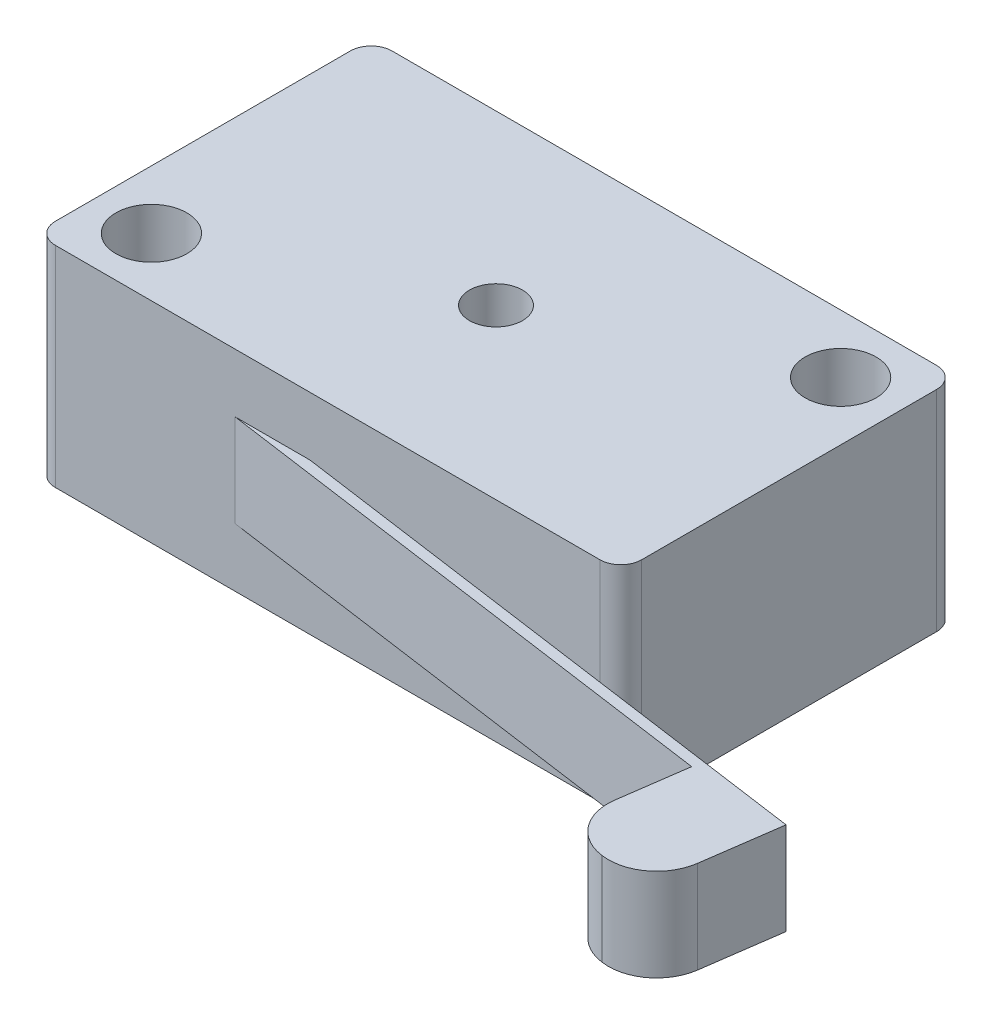
from build123d import *

# Parameters (mm, degrees)
SKETCH1_W               = 28.09
SKETCH1_H               = 16.13
BOSS_EXTRUDE1_DEPTH     = 10.05
BOSS_EXTRUDE2_DEPTH     = 2.215
FILLET1_R               = 1
CUT_EXTRUDE1_DEPTH      = 29.919874566
CUT_EXTRUDE1_DEPTH_BACK = 29.919874566
SKETCH4_R               = 1.7
SKETCH4_R_2             = 1.27
SKETCH6_W               = 4.65
SKETCH6_H               = 4.43
BOSS_EXTRUDE3_DEPTH     = 5.56
FILLET2_R               = 2.3


with BuildPart() as part:
    # Sketch1 → Boss-Extrude1 (new body)
    with BuildSketch(Plane(origin=(0, 0, 0), x_dir=(1, 0, 0), z_dir=(0, 1, 0))):
        Rectangle(SKETCH1_W, SKETCH1_H)
    extrude(amount=BOSS_EXTRUDE1_DEPTH)

    # Sketch3 → Boss-Extrude2 (add, symmetric)
    with BuildSketch(Plane(origin=(0, 5.025, 0), x_dir=(1, 0, 0), z_dir=(0, 1, 0))):
        Polygon((25.656861405, -12.042567225), (25.622068129, -12.290134243), (-4.441324134, -8.065), (-4.371737583, -7.569865966), (25.69165468, -11.795000208), align=None)
    extrude(amount=BOSS_EXTRUDE2_DEPTH, both=True)

    # Fillet1
    fillet1_edges = [part.edges().sort_by_distance(p)[0] for p in [
        (14.045, 5.025, 8.065),
        (-14.045, 5.025, 8.065),
        (-14.045, 5.025, -8.065),
        (14.045, 5.025, -8.065),
    ]]
    fillet(fillet1_edges, radius=FILLET1_R)

    # Sketch4 → Cut-Extrude1 (cut, two sides: drawn at the far end of the back side and taken through both)
    with BuildSketch(Plane(origin=(0, 5.025, 0), x_dir=(1, 0, 0), z_dir=(0, 1, 0)).offset(-CUT_EXTRUDE1_DEPTH_BACK)):
        with Locations(Location((11.245, 5.265, 0), (0, 0, 270))):
            Circle(SKETCH4_R)
        with Locations(Location((-11.245, -5.265, 0), (0, 0, 270))):
            Circle(SKETCH4_R)
        with Locations(Location((0, 0, 0), (0, 0, 270))):
            Circle(SKETCH4_R_2)
    extrude(amount=CUT_EXTRUDE1_DEPTH + CUT_EXTRUDE1_DEPTH_BACK, mode=Mode.SUBTRACT)

    # Sketch6 → Boss-Extrude3 (add)
    with BuildSketch(Plane(origin=(-1.19753232, 0, 8.520885209), x_dir=(0.9902680687415704, 0, 0.13917310096006527), z_dir=(-0.13917310096006527, 0, 0.9902680687415704))):
        with Locations((24.758172017, 5.025)):
            Rectangle(SKETCH6_W, SKETCH6_H)
    extrude(amount=BOSS_EXTRUDE3_DEPTH)

    # Fillet2
    fillet2_edges = [part.edges().sort_by_distance(p)[0] for p in [
        (24.848265688, 5.025, 17.796024705),
        (20.243519168, 5.025, 17.148869785),
    ]]
    fillet(fillet2_edges, radius=FILLET2_R)


solid = part.part
